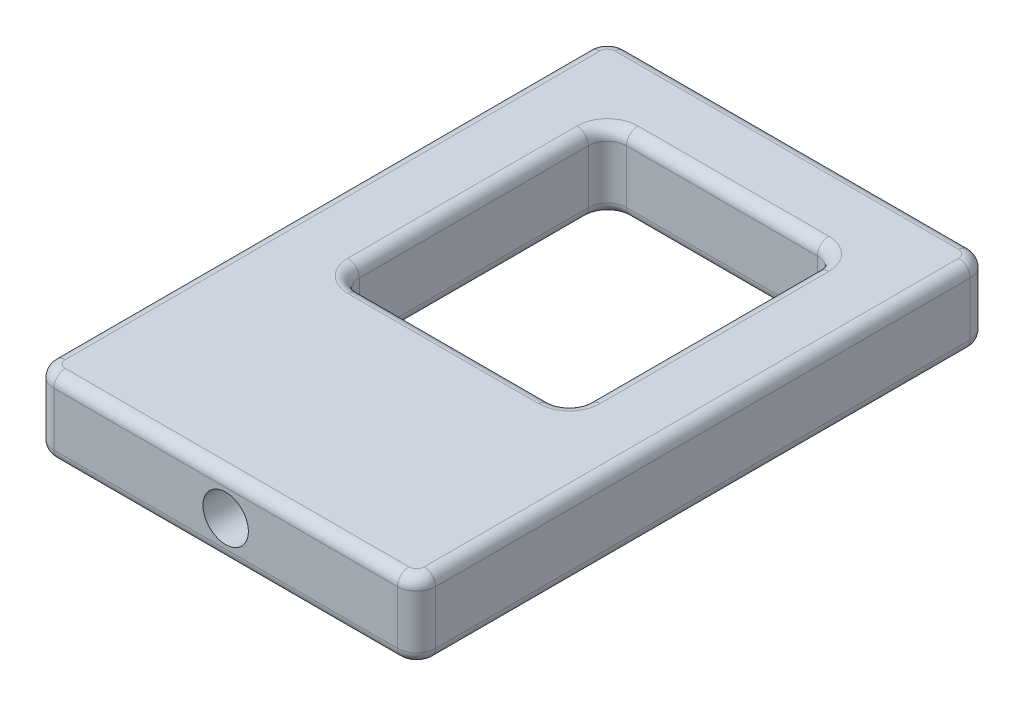
from build123d import *

# Parameters (mm, degrees)
SKETCH1_W           = 25.4
SKETCH1_H           = 38.1
BOSS_EXTRUDE1_DEPTH = 5.08
SKETCH2_W           = 15.24
SKETCH2_H           = 17.78
CUT_EXTRUDE1_DEPTH  = 24.452055347
SKETCH3_R           = 1.5113
CUT_EXTRUDE3_DEPTH  = 7.62
FILLET1_R           = 1.27
FILLET2_R           = 1.27
FILLET3_R           = 0.762
FILLET4_R           = 0.762


with BuildPart() as part:
    # Sketch1 → Boss-Extrude1 (new body)
    with BuildSketch(Plane(origin=(0, 0, 0), x_dir=(1, 0, 0), z_dir=(0, 1, 0))):
        Rectangle(SKETCH1_W, SKETCH1_H)
    extrude(amount=BOSS_EXTRUDE1_DEPTH)

    # Sketch2 → Cut-Extrude1 (cut, through all)
    with BuildSketch(Plane.XZ):
        with Locations((0, -5.08)):
            Rectangle(SKETCH2_W, SKETCH2_H)
    extrude(amount=-CUT_EXTRUDE1_DEPTH, mode=Mode.SUBTRACT)

    # Sketch3 → Cut-Extrude3 (cut)
    with BuildSketch(Plane.XY.offset(19.05)):
        with Locations((0, 2.54)):
            Circle(SKETCH3_R)
    extrude(amount=-CUT_EXTRUDE3_DEPTH, mode=Mode.SUBTRACT)

    # Fillet1
    fillet1_edges = [part.edges().sort_by_distance(p)[0] for p in [
        (12.7, 2.54, 19.05),
        (-12.7, 2.54, 19.05),
        (-12.7, 2.54, -19.05),
        (12.7, 2.54, -19.05),
    ]]
    fillet(fillet1_edges, radius=FILLET1_R)

    # Fillet2
    fillet2_edges = [part.edges().sort_by_distance(p)[0] for p in [
        (7.62, 2.54, 3.81),
        (7.62, 2.54, -13.97),
        (-7.62, 2.54, -13.97),
        (-7.62, 2.54, 3.81),
    ]]
    fillet(fillet2_edges, radius=FILLET2_R)

    # Fillet3
    fillet3_edges = [part.edges().sort_by_distance(p)[0] for p in [
        (0, 5.08, -19.05),
        (12.7, 5.08, 0),
        (-12.7, 5.08, 0),
        (0, 5.08, 19.05),
        (12.328025612, 5.08, 18.678025612),
        (-12.328025612, 5.08, 18.678025612),
        (-12.328025612, 5.08, -18.678025612),
        (12.328025612, 5.08, -18.678025612),
    ]]
    fillet(fillet3_edges, radius=FILLET3_R)

    # Fillet4
    fillet4_edges = [part.edges().sort_by_distance(p)[0] for p in [
        (0, 0, -19.05),
        (12.7, 0, 0),
        (0, 0, 19.05),
        (-12.7, 0, 0),
        (12.328025612, 0, 18.678025612),
        (-12.328025612, 0, 18.678025612),
        (-12.328025612, 0, -18.678025612),
        (12.328025612, 0, -18.678025612),
        (0, 0, -13.97),
        (0, 5.08, -13.97),
        (-7.62, 0, -5.08),
        (-7.62, 5.08, -5.08),
        (7.62, 0, -5.08),
        (7.62, 5.08, -5.08),
        (0, 0, 3.81),
        (0, 5.08, 3.81),
        (-7.248025612, 0, -13.598025612),
        (-7.248025612, 5.08, -13.598025612),
        (7.248025612, 0, -13.598025612),
        (7.248025612, 5.08, -13.598025612),
        (-7.248025612, 0, 3.438025612),
        (-7.248025612, 5.08, 3.438025612),
        (7.248025612, 0, 3.438025612),
        (7.248025612, 5.08, 3.438025612),
    ]]
    fillet(fillet4_edges, radius=FILLET4_R)


solid = part.part
